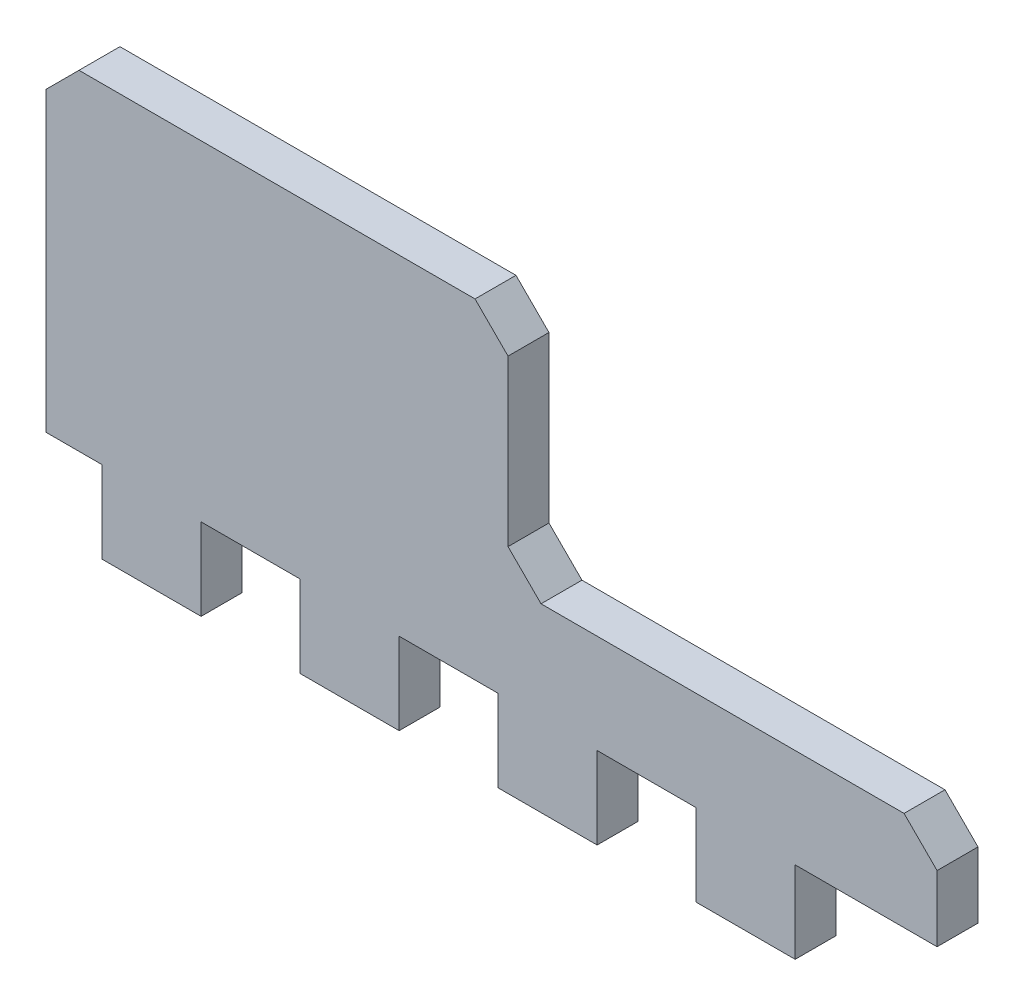
from build123d import *

# Parameters (mm, degrees)
BOSS_EXTRUDE1_DEPTH = 12.4


with BuildPart() as part:
    # Model → Boss-Extrude1 (new body)
    with BuildSketch(Plane.XY):
        Polygon((0, 0), (17, 0), (17, -24.8), (47, -24.8), (47, 0), (77, 0), (77, -24.8), (107, -24.8), (107, 0), (137, 0), (137, -24.8), (167, -24.8), (167, 0), (197, 0), (197, -24.8), (227, -24.8), (227, 0), (270, 0), (270, 20), (260, 30), (150, 30), (140, 40), (140, 90), (130, 100), (10, 100), (0, 90), align=None)
    extrude(amount=BOSS_EXTRUDE1_DEPTH)


solid = part.part
